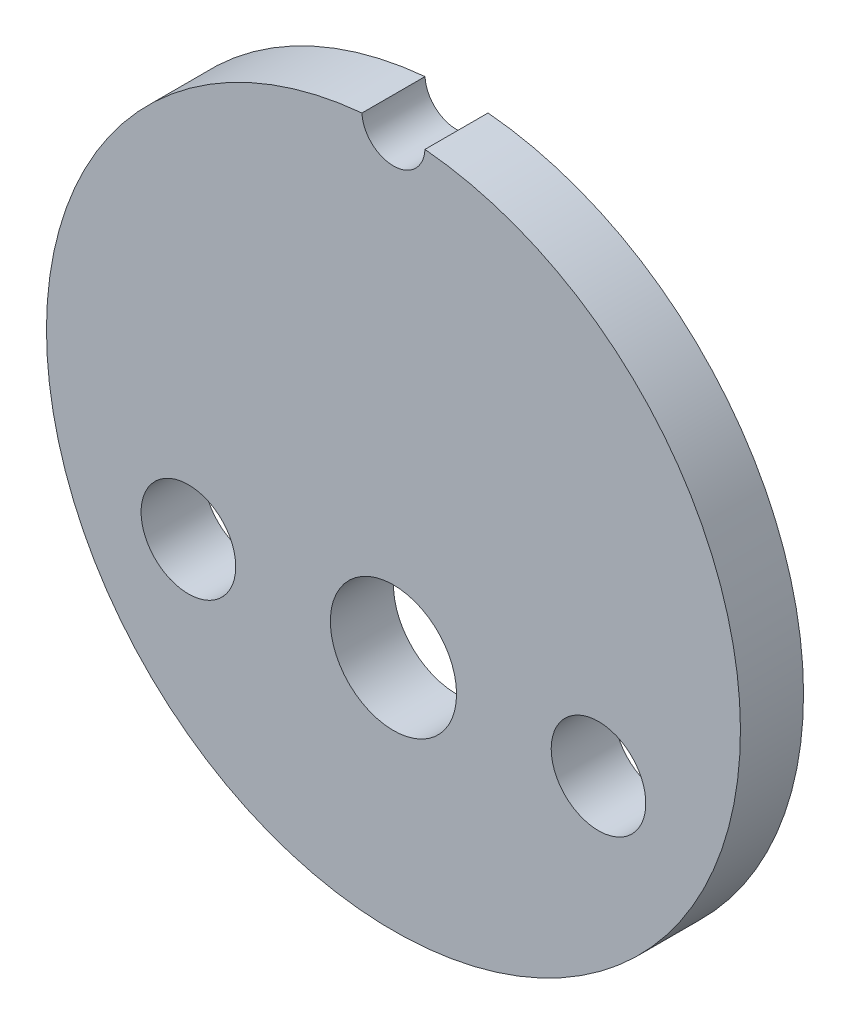
from build123d import *

# Parameters (mm, degrees)
SKETCH_1_R          = 11
SKETCH_1_R_2        = 1.5
SKETCH_1_R_3        = 2
EXTRUDE_1_DEPTH     = 2
SKETCH_2_R          = 1
CUT_EXTRUDE_1_DEPTH = 10


with BuildPart() as part:
    # 草图1 → 凸台-拉伸1 (new body)
    with BuildSketch(Plane.XY):
        with Locations((-0.589945763, 5.342825614)):
            Circle(SKETCH_1_R)
        with Locations((-7.089945763, 1.842825614)):
            Circle(SKETCH_1_R_2, mode=Mode.SUBTRACT)
        with Locations(Location((5.910054237, 1.842825614, 0), (0, 0, 180))):
            Circle(SKETCH_1_R_2, mode=Mode.SUBTRACT)
        with Locations((-0.589945763, 1.842825614)):
            Circle(SKETCH_1_R_3, mode=Mode.SUBTRACT)
    extrude(amount=EXTRUDE_1_DEPTH)

    # 草图2 → 切除-拉伸1 (cut)
    with BuildSketch(Plane(origin=(0, 0, 0), x_dir=(-1, 0, 0), z_dir=(0, 0, -1))):
        with Locations((0.589945763, 16.342825614)):
            Circle(SKETCH_2_R)
    extrude(amount=-CUT_EXTRUDE_1_DEPTH, mode=Mode.SUBTRACT)


solid = part.part
